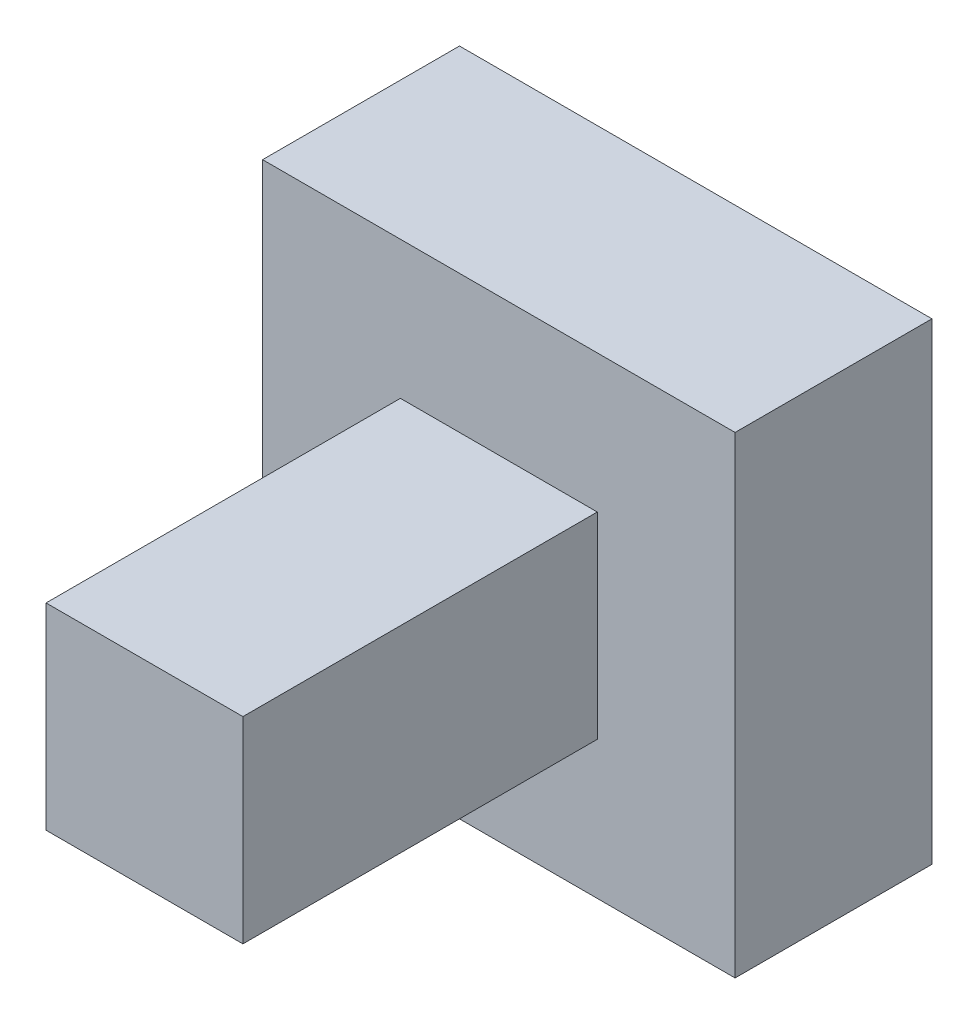
from build123d import *

# Parameters (mm, degrees)
SZKIC1_W                    = 6
SZKIC1_H                    = 6
DODANIE_WYCI_GNI_CIE1_DEPTH = 2.5
SZKIC2_W                    = 2.5
SZKIC2_H                    = 2.5
DODANIE_WYCI_GNI_CIE2_DEPTH = 4.5


with BuildPart() as part:
    # Szkic1 → Dodanie-wyciągnięcie1 (new body)
    with BuildSketch(Plane.XY):
        Rectangle(SZKIC1_W, SZKIC1_H)
    extrude(amount=DODANIE_WYCI_GNI_CIE1_DEPTH)

    # Szkic2 → Dodanie-wyciągnięcie2 (add)
    with BuildSketch(Plane.XY.offset(2.5)):
        Rectangle(SZKIC2_W, SZKIC2_H)
    extrude(amount=DODANIE_WYCI_GNI_CIE2_DEPTH)


solid = part.part
